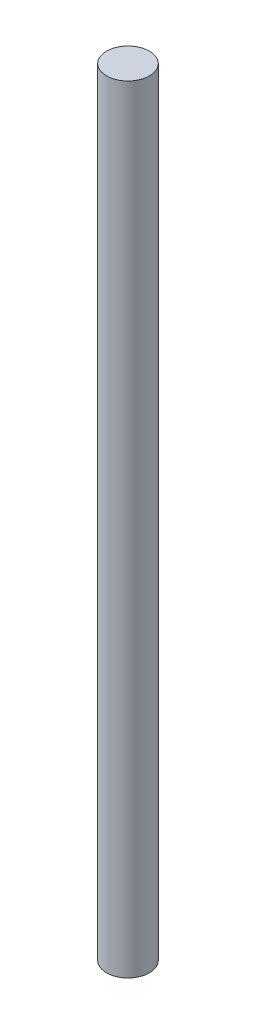
from build123d import *

# Parameters (mm, degrees)
SKETCH1_R           = 1.7526
BOSS_EXTRUDE1_DEPTH = 63.5


with BuildPart() as part:
    # Sketch1 → Boss-Extrude1 (new body)
    with BuildSketch(Plane(origin=(0, 0, 0), x_dir=(1, 0, 0), z_dir=(0, 1, 0))):
        with Locations(Location((0, 0, 0), (0, 0, 270))):
            Circle(SKETCH1_R)
    extrude(amount=BOSS_EXTRUDE1_DEPTH)


solid = part.part
